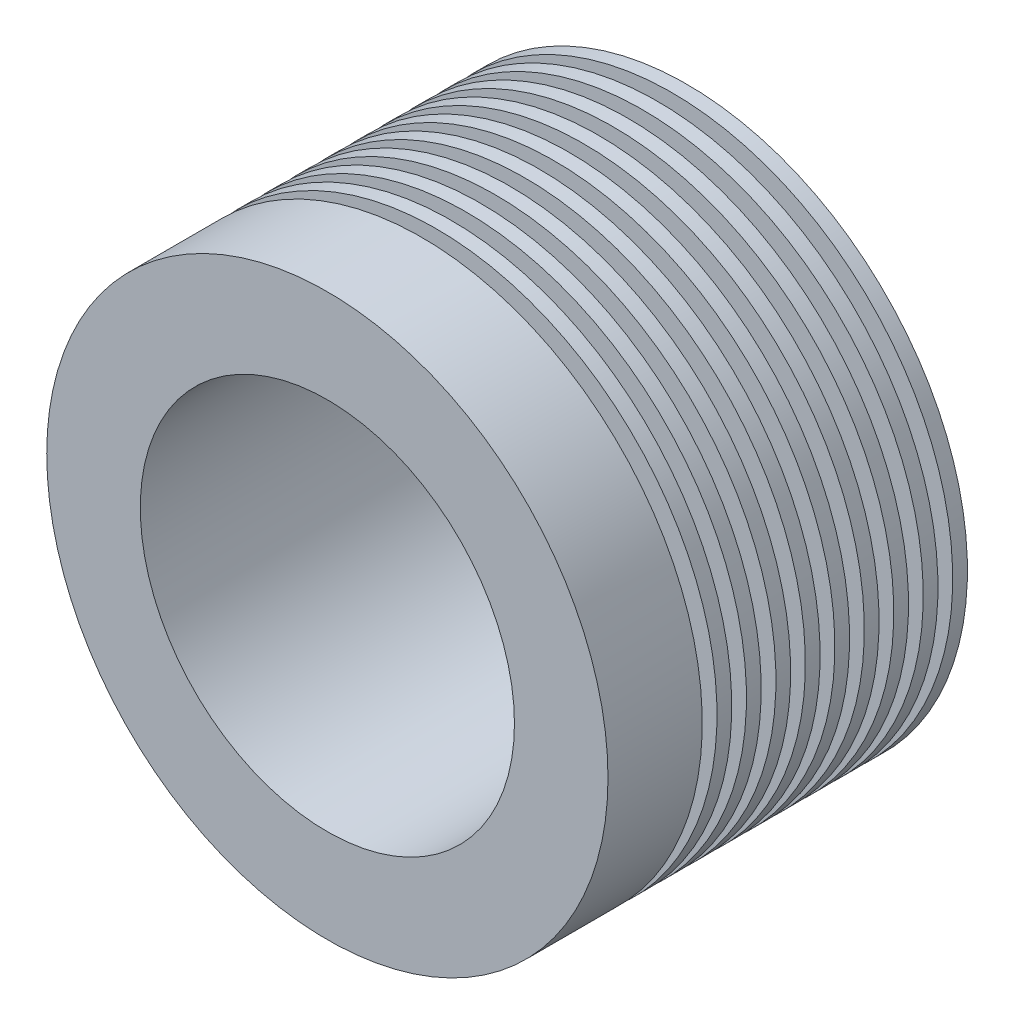
from build123d import *

# Parameters (mm, degrees)
ESQUISSE1_R                = 38.1
BOSS_EXTRU_1_DEPTH         = 50.8
ESQUISSE2_OUTSIDE_W        = 102.028
ESQUISSE2_OUTSIDE_H        = 102.028
ESQUISSE2_OUTSIDE_R        = 31.75
ENL_V_MAT_EXTRU_3_DEPTH    = 2
R_P_TITION_LIN_AIRE1_COUNT = 10
R_P_TITION_LIN_AIRE1_PITCH = 4
ESQUISSE5_R                = 25.4
ENL_V_MAT_EXTRU_5_DEPTH    = 44.45


with BuildPart() as part:
    # Esquisse1 → Boss.-Extru.1 (new body)
    with BuildSketch(Plane.XY):
        Circle(ESQUISSE1_R)
    extrude(amount=BOSS_EXTRU_1_DEPTH)

    # Esquisse2 outside → Enlèv. mat.-Extru.3 (cut)
    with BuildSketch(Plane(origin=(0, 0, 0), x_dir=(-1, 0, 0), z_dir=(0, 0, -1))):
        Rectangle(ESQUISSE2_OUTSIDE_W, ESQUISSE2_OUTSIDE_H)
        Circle(ESQUISSE2_OUTSIDE_R, mode=Mode.SUBTRACT)
    enl_v_mat_extru_3 = extrude(amount=-ENL_V_MAT_EXTRU_3_DEPTH, mode=Mode.SUBTRACT)

    # Répétition linéaire1: Enlèv. mat.-Extru.3 ×10
    with Locations(*[(0, 0, i * R_P_TITION_LIN_AIRE1_PITCH) for i in range(1, R_P_TITION_LIN_AIRE1_COUNT)]):
        add(enl_v_mat_extru_3, mode=Mode.SUBTRACT)

    # Esquisse5 → Enlèv. mat.-Extru.5 (cut)
    with BuildSketch(Plane.XY.offset(50.8)):
        Circle(ESQUISSE5_R)
    extrude(amount=-ENL_V_MAT_EXTRU_5_DEPTH, mode=Mode.SUBTRACT)


solid = part.part
